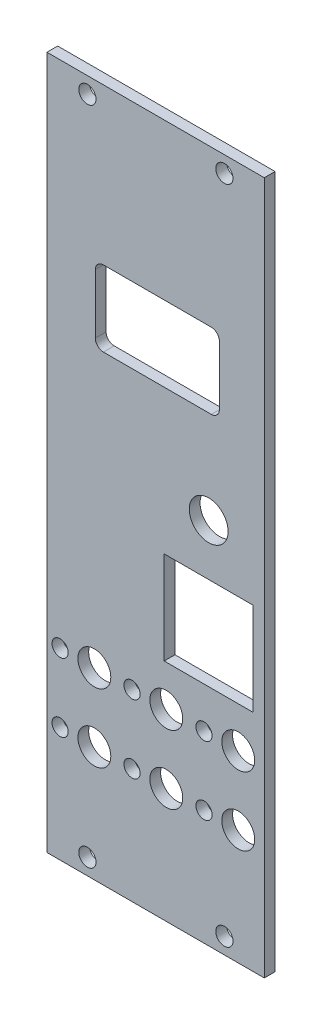
from build123d import *

# Parameters (mm, degrees)
SKETCH2_W           = 40.3
SKETCH2_H           = 128.5
SKETCH2_R           = 1.6
SKETCH2_R_2         = 3.05
SKETCH2_R_3         = 1.5
SKETCH2_R_4         = 3.6
SKETCH2_W_2         = 16.5
SKETCH2_H_2         = 17.2
BOSS_EXTRUDE2_DEPTH = 2


with BuildPart() as part:
    # Sketch2 → Boss-Extrude2 (new body)
    with BuildSketch(Plane.XY):
        with Locations((20.15, 64.25)):
            Rectangle(SKETCH2_W, SKETCH2_H)
        with Locations((7.5, 125.5)):
            Circle(SKETCH2_R, mode=Mode.SUBTRACT)
        with Locations((32.9, 125.5)):
            Circle(SKETCH2_R, mode=Mode.SUBTRACT)
        with Locations((7.5, 3)):
            Circle(SKETCH2_R, mode=Mode.SUBTRACT)
        with Locations((32.9, 3)):
            Circle(SKETCH2_R, mode=Mode.SUBTRACT)
        with Locations((8.79, 34.05)):
            Circle(SKETCH2_R_2, mode=Mode.SUBTRACT)
        with Locations((8.79, 21.35)):
            Circle(SKETCH2_R_2, mode=Mode.SUBTRACT)
        with Locations((22.13, 34.05)):
            Circle(SKETCH2_R_2, mode=Mode.SUBTRACT)
        with Locations((22.13, 21.35)):
            Circle(SKETCH2_R_2, mode=Mode.SUBTRACT)
        with Locations((35.47, 21.35)):
            Circle(SKETCH2_R_2, mode=Mode.SUBTRACT)
        with Locations((35.47, 34.05)):
            Circle(SKETCH2_R_2, mode=Mode.SUBTRACT)
        with Locations((2.44, 34.05)):
            Circle(SKETCH2_R_3, mode=Mode.SUBTRACT)
        with Locations((15.78, 34.05)):
            Circle(SKETCH2_R_3, mode=Mode.SUBTRACT)
        with Locations((29.12, 34.05)):
            Circle(SKETCH2_R_3, mode=Mode.SUBTRACT)
        with Locations((2.44, 21.35)):
            Circle(SKETCH2_R_3, mode=Mode.SUBTRACT)
        with Locations((15.78, 21.35)):
            Circle(SKETCH2_R_3, mode=Mode.SUBTRACT)
        with Locations((29.12, 21.35)):
            Circle(SKETCH2_R_3, mode=Mode.SUBTRACT)
        with Locations((29.99, 68.34)):
            Circle(SKETCH2_R_4, mode=Mode.SUBTRACT)
        with Locations((29.99, 50.22)):
            Rectangle(SKETCH2_W_2, SKETCH2_H_2, mode=Mode.SUBTRACT)
        with BuildLine():
            Line((10.47, 99.59), (30.47, 99.59))
            ThreePointArc((30.47, 99.59), (31.530660172, 99.150660172), (31.97, 98.09))
            Line((31.97, 98.09), (31.97, 87.09))
            ThreePointArc((31.97, 87.09), (31.530660172, 86.029339828), (30.47, 85.59))
            Line((30.47, 85.59), (10.47, 85.59))
            ThreePointArc((10.47, 85.59), (9.409339828, 86.029339828), (8.97, 87.09))
            Line((8.97, 87.09), (8.97, 98.09))
            ThreePointArc((8.97, 98.09), (9.409339828, 99.150660172), (10.47, 99.59))
        make_face(mode=Mode.SUBTRACT)
    extrude(amount=BOSS_EXTRUDE2_DEPTH)


solid = part.part
